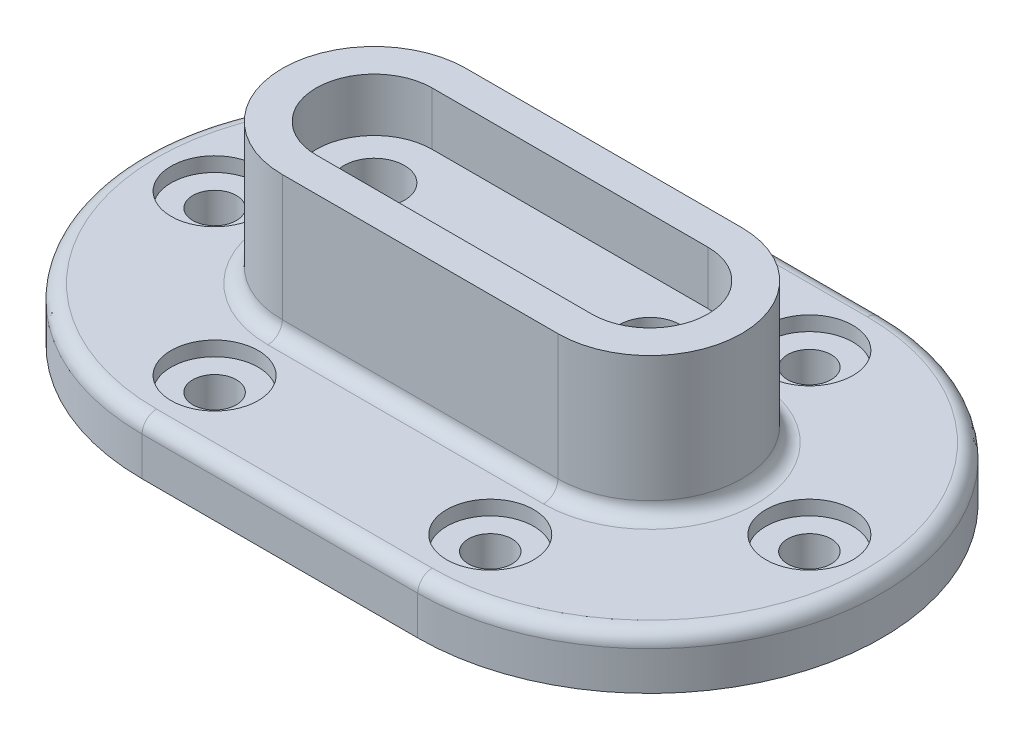
from build123d import *

# Parameters (mm, degrees)
EXTRUDE_1_DEPTH     = 11
SKETCH_4_R          = 9
SKETCH_4_R_2        = 4.5
CUT_EXTRUDE_1_DEPTH = 3
SKETCH_4_3_R        = 4.5
CUT_EXTRUDE_2_DEPTH = 11
EXTRUDE_3_DEPTH     = 40
EXTRUDE_4_DEPTH     = 29
SKETCH_8_R          = 6.25
CUT_EXTRUDE_3_DEPTH = 150.66913845
FILLET_1_R          = 3
FILLET_2_R          = 3


with BuildPart() as part:
    # 스케치1 → 보스-돌출1 (new body)
    with BuildSketch(Plane(origin=(0, 0, 0), x_dir=(1, 0, 0), z_dir=(0, 1, 0))):
        with BuildLine():
            Line((33.765453209, 48), (90.765453209, 48))
            ThreePointArc((90.765453209, 48), (138.765453209, 0), (90.765453209, -48))
            Line((90.765453209, -48), (33.765453209, -48))
            ThreePointArc((33.765453209, -48), (-14.234546791, 0), (33.765453209, 48))
        make_face()
    extrude(amount=EXTRUDE_1_DEPTH)

    # 스케치4 → 컷-돌출1 (cut)
    # profile 1 of 6: a face of its own
    with BuildSketch(Plane(origin=(0, 11, 0), x_dir=(1, 0, 0), z_dir=(0, 1, 0))):
        with Locations((33.765453209, 33)):
            Circle(SKETCH_4_R)
        with Locations((33.765453209, 33)):
            Circle(SKETCH_4_R_2, mode=Mode.SUBTRACT)
    # profile 2 of 6: a face of its own
    with BuildSketch(Plane(origin=(0, 11, 0), x_dir=(1, 0, 0), z_dir=(0, 1, 0))):
        with Locations((90.765453209, 33)):
            Circle(SKETCH_4_R)
        with Locations((90.765453209, 33)):
            Circle(SKETCH_4_R_2, mode=Mode.SUBTRACT)
    # profile 3 of 6: a face of its own
    with BuildSketch(Plane(origin=(0, 11, 0), x_dir=(1, 0, 0), z_dir=(0, 1, 0))):
        with Locations((123.765453209, 0)):
            Circle(SKETCH_4_R)
        with Locations((123.765453209, 0)):
            Circle(SKETCH_4_R_2, mode=Mode.SUBTRACT)
    # profile 4 of 6: a face of its own
    with BuildSketch(Plane(origin=(0, 11, 0), x_dir=(1, 0, 0), z_dir=(0, 1, 0))):
        with Locations((90.765453209, -33)):
            Circle(SKETCH_4_R)
        with Locations((90.765453209, -33)):
            Circle(SKETCH_4_R_2, mode=Mode.SUBTRACT)
    # profile 5 of 6: a face of its own
    with BuildSketch(Plane(origin=(0, 11, 0), x_dir=(1, 0, 0), z_dir=(0, 1, 0))):
        with Locations((33.765453209, -33)):
            Circle(SKETCH_4_R)
        with Locations((33.765453209, -33)):
            Circle(SKETCH_4_R_2, mode=Mode.SUBTRACT)
    # profile 6 of 6: a face of its own
    with BuildSketch(Plane(origin=(0, 11, 0), x_dir=(1, 0, 0), z_dir=(0, 1, 0))):
        with Locations((0.765453209, 0)):
            Circle(SKETCH_4_R)
        with Locations((0.765453209, 0)):
            Circle(SKETCH_4_R_2, mode=Mode.SUBTRACT)
    extrude(amount=-CUT_EXTRUDE_1_DEPTH, mode=Mode.SUBTRACT)

    # 스케치4<3> → 컷-돌출2 (cut)
    with BuildSketch(Plane(origin=(0, 11, 0), x_dir=(1, 0, 0), z_dir=(0, 1, 0))):
        with Locations((33.765453209, 33)):
            Circle(SKETCH_4_3_R)
        with Locations((90.765453209, 33)):
            Circle(SKETCH_4_3_R)
        with Locations((123.765453209, 0)):
            Circle(SKETCH_4_3_R)
        with Locations((90.765453209, -33)):
            Circle(SKETCH_4_3_R)
        with Locations((33.765453209, -33)):
            Circle(SKETCH_4_3_R)
        with Locations((0.765453209, 0)):
            Circle(SKETCH_4_3_R)
    extrude(amount=-CUT_EXTRUDE_2_DEPTH, mode=Mode.SUBTRACT)

    # 스케치1<5> → 보스-돌출3 (add)
    with BuildSketch(Plane(origin=(0, 0, 0), x_dir=(1, 0, 0), z_dir=(0, 1, 0))):
        with BuildLine():
            Line((90.765453209, 19), (33.765453209, 19))
            ThreePointArc((33.765453209, 19), (14.765453209, 0), (33.765453209, -19))
            Line((33.765453209, -19), (90.765453209, -19))
            ThreePointArc((90.765453209, -19), (109.765453209, 0), (90.765453209, 19))
        make_face()
        with BuildLine():
            ThreePointArc((33.765453209, -12), (21.765453209, 0), (33.765453209, 12))
            Line((33.765453209, 12), (90.765453209, 12))
            ThreePointArc((90.765453209, 12), (102.765453209, 0), (90.765453209, -12))
            Line((90.765453209, -12), (33.765453209, -12))
        make_face(mode=Mode.SUBTRACT)
    extrude(amount=EXTRUDE_3_DEPTH)

    # 스케치1<6> → 보스-돌출4 (add)
    with BuildSketch(Plane(origin=(0, 0, 0), x_dir=(1, 0, 0), z_dir=(0, 1, 0))):
        with BuildLine():
            Line((90.765453209, 12), (33.765453209, 12))
            ThreePointArc((33.765453209, 12), (21.765453209, 0), (33.765453209, -12))
            Line((33.765453209, -12), (90.765453209, -12))
            ThreePointArc((90.765453209, -12), (102.765453209, 0), (90.765453209, 12))
        make_face()
    extrude(amount=EXTRUDE_4_DEPTH)

    # 스케치8 → 컷-돌출3 (cut, through all)
    with BuildSketch(Plane(origin=(0, 29, 0), x_dir=(1, 0, 0), z_dir=(0, 1, 0))):
        with Locations((33.765453209, 0)):
            Circle(SKETCH_8_R)
        with Locations((90.765453209, 0)):
            Circle(SKETCH_8_R)
    extrude(amount=-CUT_EXTRUDE_3_DEPTH, mode=Mode.SUBTRACT)

    # 필렛1
    fillet_1_edges = [part.edges().sort_by_distance(p)[0] for p in [
        (-14.234546791, 11, 0),
        (62.265453209, 11, -48),
        (138.765453209, 11, 0),
        (62.265453209, 11, 48),
    ]]
    fillet(fillet_1_edges, radius=FILLET_1_R)

    # 필렛2
    fillet_2_edges = [part.edges().sort_by_distance(p)[0] for p in [
        (62.265453209, 11, -19),
        (14.765453209, 11, 0),
        (109.765453209, 11, 0),
        (62.265453209, 11, 19),
    ]]
    fillet(fillet_2_edges, radius=FILLET_2_R)


solid = part.part
